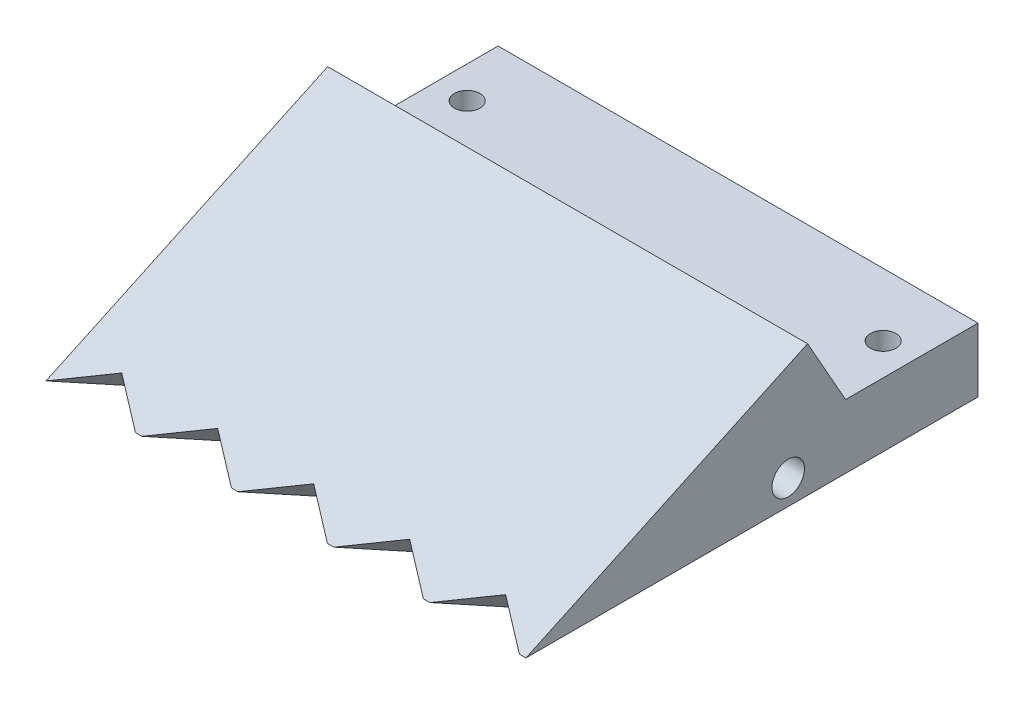
from build123d import *

# Parameters (mm, degrees)
BOSS_EXTRUDE1_DEPTH = 75
SKETCH2_R           = 2
CUT_EXTRUDE1_DEPTH  = 10
CUT_EXTRUDE2_DEPTH  = 10
SKETCH3_R           = 2.543008444
CUT_EXTRUDE3_DEPTH  = 100
CHAMFER1_SIZE       = 2


with BuildPart() as part:
    # Sketch1 → Boss-Extrude1 (new body)
    with BuildSketch(Plane(origin=(0, 0, 0), x_dir=(0, 0, -1), z_dir=(1, 0, 0))):
        Polygon((-35.447605249, 4.173188871), (35.206481481, 4.173188871), (35.206481481, 14.173188871), (14.511910864, 14.173188871), (8.571096195, 24.699446456), align=None)
    extrude(amount=BOSS_EXTRUDE1_DEPTH)

    # Sketch2 → Cut-Extrude1 (cut)
    with BuildSketch(Plane(origin=(0, 14.173188871, 0), x_dir=(1, 0, 0), z_dir=(0, 1, 0))):
        with Locations(Location((5, 25.374559272, 0), (0, 0, 270))):
            Circle(SKETCH2_R)
        with Locations(Location((69.999998955, 25.38621548, 0), (0, 0, 270))):
            Circle(SKETCH2_R)
    extrude(amount=-CUT_EXTRUDE1_DEPTH, mode=Mode.SUBTRACT)

    # Sketch4 → Cut-Extrude2 (cut)
    with BuildSketch(Plane(origin=(0, 17.005051997, 7.929585973), x_dir=(1, 0, 0), z_dir=(0, 0.9063077870366527, 0.4226182617406937))):
        Polygon((0, -30.362774842), (7.065850082, -25.103103439), (13.976560291, -30.362774842), align=None)
        Polygon((22.065850082, -25.103103439), (28.976560291, -30.362774842), (15, -30.362774842), align=None)
        Polygon((37.065850082, -25.103103439), (43.976560291, -30.362774842), (30, -30.362774842), align=None)
        Polygon((52.065850082, -25.103103439), (58.976560291, -30.362774842), (45, -30.362774842), align=None)
        Polygon((67.065850082, -25.103103439), (73.976560291, -30.362774842), (60, -30.362774842), align=None)
    extrude(amount=-CUT_EXTRUDE2_DEPTH, mode=Mode.SUBTRACT)

    # Sketch3 → Cut-Extrude3 (cut)
    with BuildSketch(Plane.ZY):
        with Locations((-5.547587106, 8.033515635)):
            Circle(SKETCH3_R)
    extrude(amount=-CUT_EXTRUDE3_DEPTH, mode=Mode.SUBTRACT)

    # Chamfer1
    chamfer1_edges = [part.edges().sort_by_distance(p)[0] for p in [
        (5, 4.173188871, -27.374559272),
        (69.999998955, 4.173188871, -27.38621548),
    ]]
    chamfer(chamfer1_edges, length=CHAMFER1_SIZE)


solid = part.part
